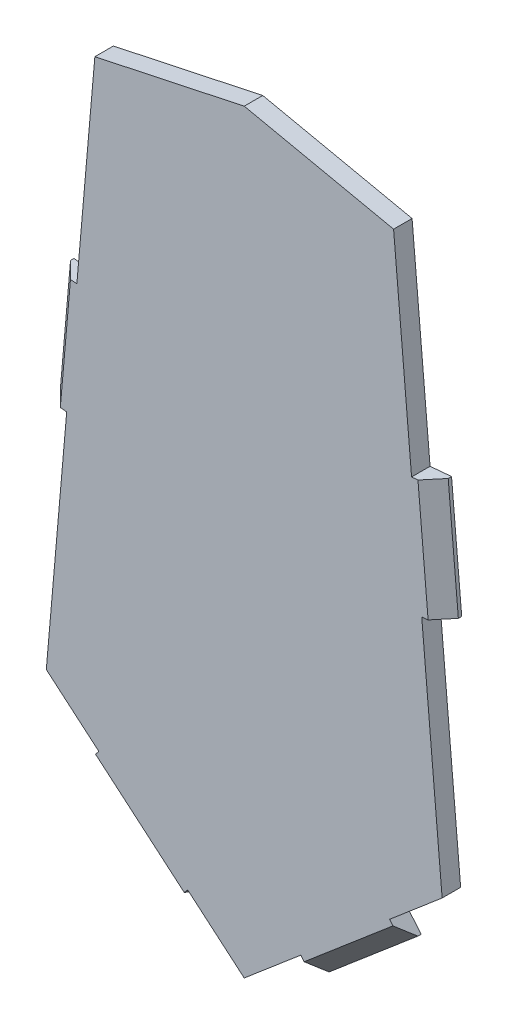
from build123d import *

# Parameters (mm, degrees)
BOSS_EXTRUDE2_DEPTH = 3.175
CHAMFER3_SIZE       = 2.6


with BuildPart() as part:
    # Sketch2 → Boss-Extrude2 (new body)
    with BuildSketch(Plane.XY):
        Polygon((33.967630838, -35.823456397), (25.63439182, 59.425901431), (0, 64.888689731), (-25.63439182, 59.425901431), (-33.967630838, -35.823456397), (0, -64.691310269), align=None)
        Polygon((-30.464841537, 4.213608519), (-28.721726682, 24.137502481), (-32.407647065, 24.459978729), (-34.15076192, 4.536084767), align=None)
        Polygon((32.407647065, 24.459978729), (28.721726682, 24.137502481), (30.464841537, 4.213608519), (34.15076192, 4.536084767), align=None)
        Polygon((27.2046006, -46.164342336), (24.938042288, -43.497375254), (9.698230388, -56.449137036), (11.9647887, -59.116104119), align=None)
        Polygon((-9.698230388, -56.449137036), (-24.938042288, -43.497375254), (-27.2046006, -46.164342336), (-11.9647887, -59.116104119), align=None)
    extrude(amount=BOSS_EXTRUDE2_DEPTH)

    # Chamfer3
    chamfer3_edges = [part.edges().sort_by_distance(p)[0] for p in [
        (19.58469465, -52.640223227, 3.175),
        (33.279204493, 14.498031748, 3.175),
        (-33.279204493, 14.498031748, 3.175),
        (-19.58469465, -52.640223227, 3.175),
    ]]
    chamfer(chamfer3_edges, length=CHAMFER3_SIZE)


solid = part.part
